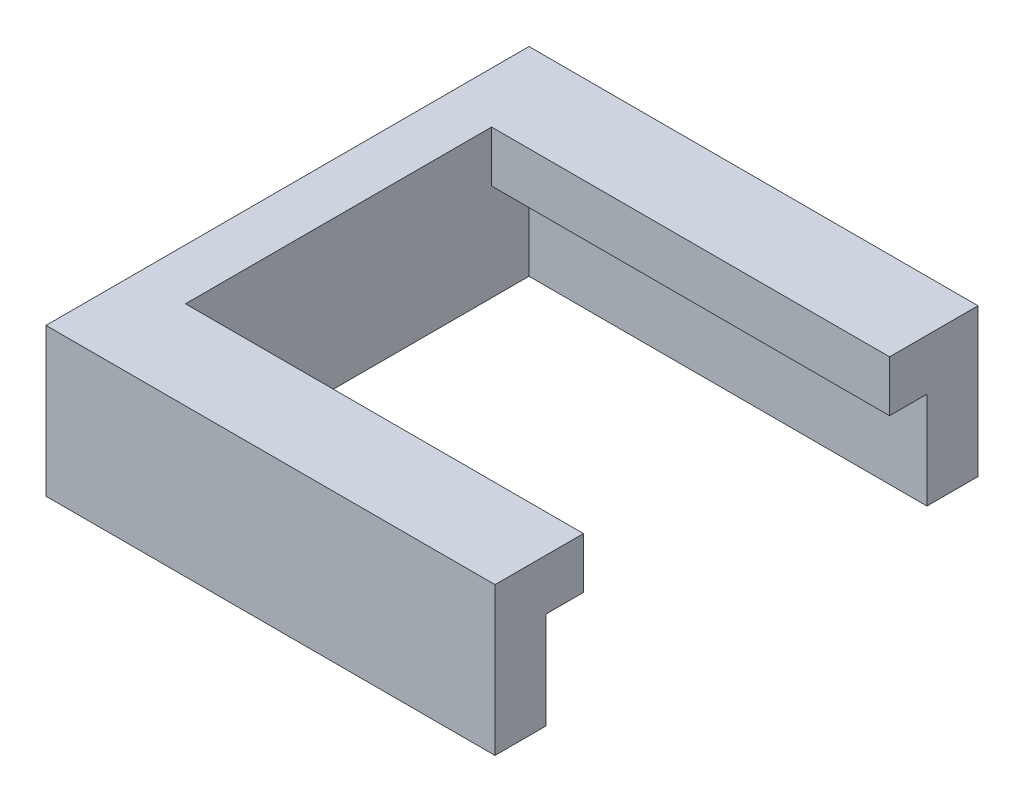
from build123d import *

# Parameters (mm, degrees)
CROQUIS1_W              = 26.4
CROQUIS1_H              = 28.4
SALIENTE_EXTRUIR1_DEPTH = 8.7
CROQUIS2_W              = 22.4
CROQUIS2_H              = 5.7
CORTAR_EXTRUIR1_DEPTH   = 23.4
CROQUIS3_W              = 18
CROQUIS3_H              = 3
CORTAR_EXTRUIR2_DEPTH   = 23.4


with BuildPart() as part:
    # Croquis1 → Saliente-Extruir1 (new body)
    with BuildSketch(Plane(origin=(0, 0, 0), x_dir=(1, 0, 0), z_dir=(0, 1, 0))):
        with Locations((2.461702128, 4.502659574)):
            Rectangle(CROQUIS1_W, CROQUIS1_H)
    extrude(amount=SALIENTE_EXTRUIR1_DEPTH)

    # Croquis2 → Cortar-Extruir1 (cut)
    with BuildSketch(Plane(origin=(15.661702128, 0, 0), x_dir=(0, 0, -1), z_dir=(1, 0, 0))):
        with Locations((4.502659574, 2.85)):
            Rectangle(CROQUIS2_W, CROQUIS2_H)
    extrude(amount=-CORTAR_EXTRUIR1_DEPTH, mode=Mode.SUBTRACT)

    # Croquis3 → Cortar-Extruir2 (cut)
    with BuildSketch(Plane(origin=(15.661702128, 0, 0), x_dir=(0, 0, -1), z_dir=(1, 0, 0))):
        with Locations((4.502659574, 7.2)):
            Rectangle(CROQUIS3_W, CROQUIS3_H)
    extrude(amount=-CORTAR_EXTRUIR2_DEPTH, mode=Mode.SUBTRACT)


solid = part.part
